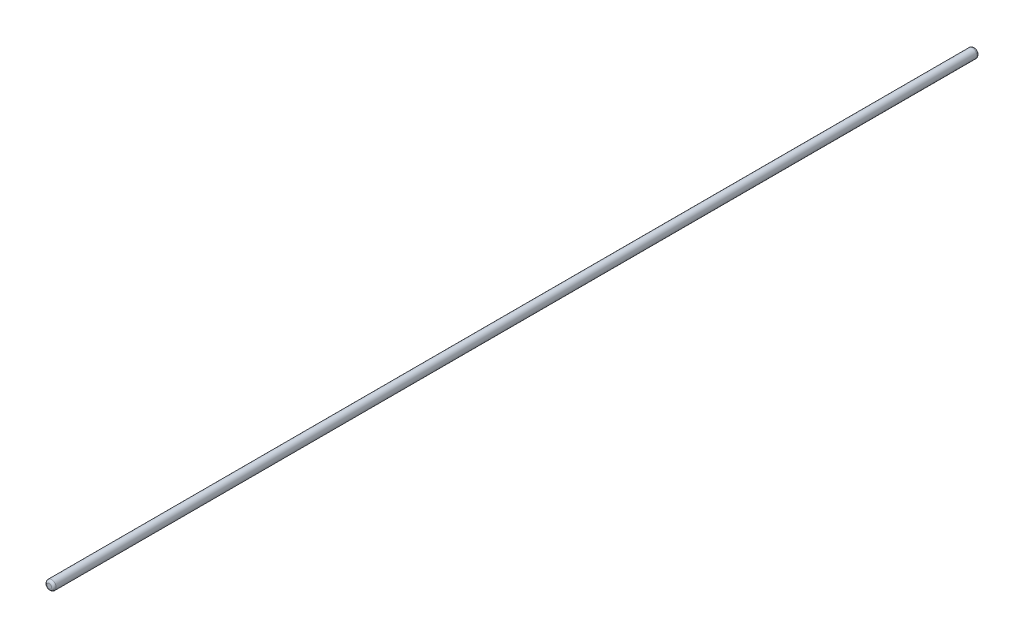
from build123d import *

# Parameters (mm, degrees)
SKETCH1_R           = 1.5
BOSS_EXTRUDE1_DEPTH = 300
FILLET1_R           = 0.75


with BuildPart() as part:
    # Sketch1 → Boss-Extrude1 (new body)
    with BuildSketch(Plane(origin=(0, 0, 0), x_dir=(0, 1, 0), z_dir=(0, 0, 1))):
        with Locations(Location((0, 0, 0), (0, 0, 270))):
            Circle(SKETCH1_R)
    extrude(amount=BOSS_EXTRUDE1_DEPTH)

    # Fillet1
    fillet1_edges = [part.edges().sort_by_distance(p)[0] for p in [
        (-1.5, 0, 0),
        (-1.5, 0, 300),
    ]]
    fillet(fillet1_edges, radius=FILLET1_R)


solid = part.part
